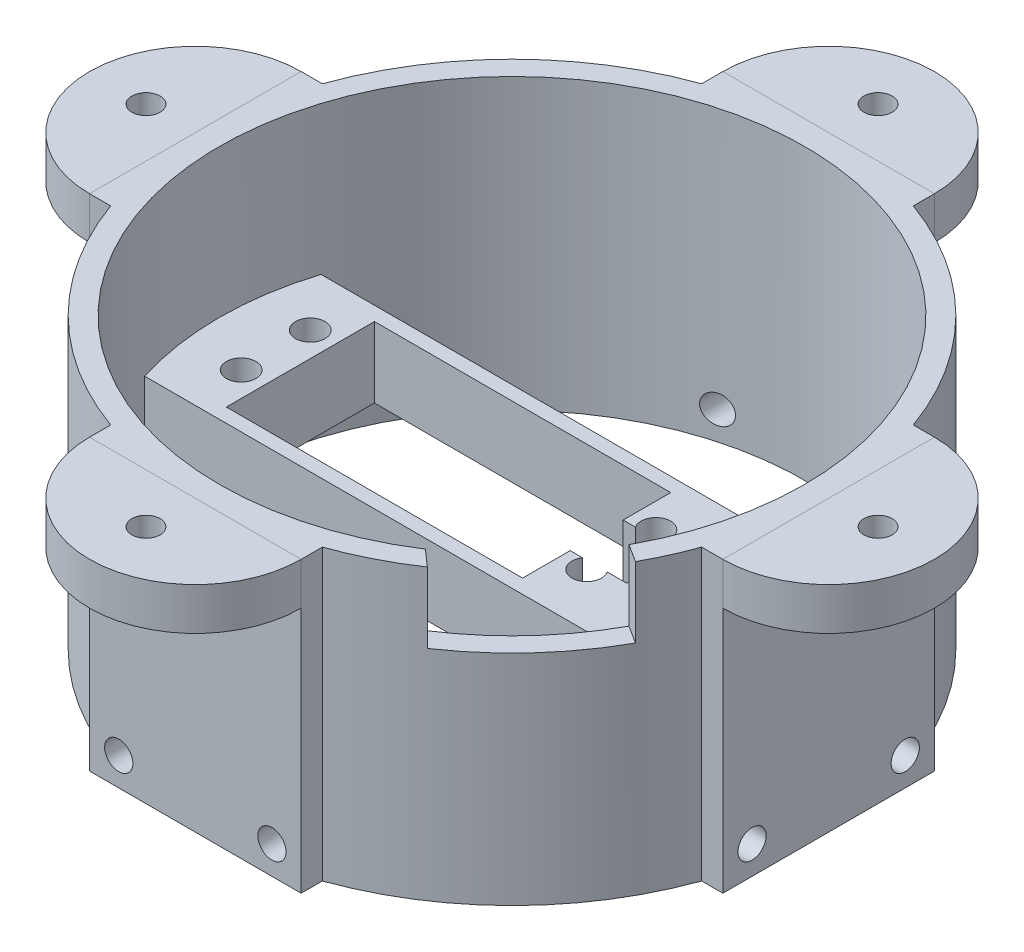
from build123d import *
from build123d.topology import SkipClean

# Parameters (mm, degrees)
SKETCH1_R             = 44.5
SKETCH1_R_2           = 41.5
BOSS_EXTRUDE1_DEPTH   = 41
SKETCH2_R             = 2.1
SKETCH2_W             = 42
SKETCH2_H             = 21
BOSS_EXTRUDE2_DEPTH   = 20
BOSS_EXTRUDE3_DEPTH   = 41
CIRPATTERN1_COUNT     = 4
SKETCH4_R             = 2
CUT_EXTRUDE1_DEPTH    = 7
CUT_EXTRUDE2_DEPTH    = 10
CIRPATTERN2_COUNT     = 4
SKETCH6_R             = 2
BOSS_EXTRUDE4_DEPTH   = 6
BOSS_EXTRUDE4_2_DEPTH = 6
BOSS_EXTRUDE4_3_DEPTH = 6
BOSS_EXTRUDE4_4_DEPTH = 6
SKETCH8_W             = 8
SKETCH8_H             = 7.5
CUT_EXTRUDE3_DEPTH    = 60
CUT_EXTRUDE4_START    = -10
CUT_EXTRUDE4_DEPTH    = 10


with BuildPart() as part:
    # Sketch1 → Boss-Extrude1 (new body)
    with BuildSketch(Plane(origin=(0, 0, 0), x_dir=(1, 0, 0), z_dir=(0, 1, 0))):
        with Locations(Location((0, 0, 0), (0, 0, 270))):
            Circle(SKETCH1_R)
        with Locations(Location((0, 0, 0), (0, 0, 270))):
            Circle(SKETCH1_R_2, mode=Mode.SUBTRACT)
    extrude(amount=BOSS_EXTRUDE1_DEPTH)

    # Sketch2 → Boss-Extrude2 (add)
    with BuildSketch(Plane(origin=(0, 0, 0), x_dir=(1, 0, 0), z_dir=(0, 1, 0))):
        with BuildLine():
            Line((-39.572717875, 12.5), (39.572717875, 12.5))
            ThreePointArc((39.572717875, 12.5), (41.658434963, 0), (39.572717875, -12.5))
            Line((39.572717875, -12.5), (-39.572717875, -12.5))
            ThreePointArc((-39.572717875, -12.5), (-41.658434963, 0), (-39.572717875, 12.5))
        make_face()
        with Locations(Location((15.5, 4.9, 0), (0, 0, 270))):
            Circle(SKETCH2_R, mode=Mode.SUBTRACT)
        with Locations(Location((15.5, -4.9, 0), (0, 0, 270))):
            Circle(SKETCH2_R, mode=Mode.SUBTRACT)
        with Locations(Location((-33.5, 4.9, 0), (0, 0, 90))):
            Circle(SKETCH2_R, mode=Mode.SUBTRACT)
        with Locations(Location((-33.5, -4.9, 0), (0, 0, 90))):
            Circle(SKETCH2_R, mode=Mode.SUBTRACT)
        with Locations((-9, 0)):
            Rectangle(SKETCH2_W, SKETCH2_H, mode=Mode.SUBTRACT)
    extrude(amount=BOSS_EXTRUDE2_DEPTH)

    # Sketch3 → Boss-Extrude3 (add)
    with BuildSketch(Plane(origin=(0, 0, 0), x_dir=(1, 0, 0), z_dir=(0, 1, 0))):
        with BuildLine():
            Line((0, 44.895703837), (-15, 44.895703837))
            Line((-15, 44.895703837), (-15, 41.895703837))
            ThreePointArc((-15, 41.895703837), (0, 44.5), (15, 41.895703837))
            Line((15, 41.895703837), (15, 44.895703837))
            Line((15, 44.895703837), (0, 44.895703837))
        make_face()
    boss_extrude3 = extrude(amount=BOSS_EXTRUDE3_DEPTH)

    # CirPattern1: Boss-Extrude3 ×4 about axis
    cirpattern1_axis = Axis((0, 0, 0), (0, 1, 0))
    for i in range(1, CIRPATTERN1_COUNT):
        add(boss_extrude3.rotate(cirpattern1_axis, i * 360 / CIRPATTERN1_COUNT))

    # Sketch4 → Cut-Extrude1 (cut)
    with BuildSketch(Plane.ZY.offset(44.895703837)):
        with Locations((10.859802344, 4)):
            Circle(SKETCH4_R)
        with Locations(Location((-10.859802344, 4, 0), (0, 0, 214.905312115))):
            Circle(SKETCH4_R)
    cut_extrude1 = extrude(amount=-CUT_EXTRUDE1_DEPTH, mode=Mode.SUBTRACT)

    # Sketch5 → Cut-Extrude2 (cut)
    with SkipClean():  # the faces are left unmerged after this step: merging them gives an invalid solid
        with BuildSketch(Plane(origin=(0, 0, 0), x_dir=(1, 0, 0), z_dir=(0, 1, 0))):
            with BuildLine():
                Line((-39.572717875, 12.5), (39.572717875, 12.5))
                ThreePointArc((39.572717875, 12.5), (41.5, 0), (39.572717875, -12.5))
                Line((39.572717875, -12.5), (-39.572717875, -12.5))
                ThreePointArc((-39.572717875, -12.5), (-41.5, 0), (-39.572717875, 12.5))
            make_face()
        extrude(amount=CUT_EXTRUDE2_DEPTH, mode=Mode.SUBTRACT)

    # CirPattern2: Cut-Extrude1 ×4 about axis
    with SkipClean():  # the faces are left unmerged after this step: merging them gives an invalid solid
        cirpattern2_axis = Axis((0, 41, 0), (0, -1, 0))
        for i in range(1, CIRPATTERN2_COUNT):
            add(cut_extrude1.rotate(cirpattern2_axis, i * 360 / CIRPATTERN2_COUNT), mode=Mode.SUBTRACT)

    # Sketch8 → Cut-Extrude3 (cut)
    with SkipClean():  # the faces are left unmerged after this step: merging them gives an invalid solid
        with BuildSketch(Plane(origin=(0, 0, 0), x_dir=(1, 0, 0), z_dir=(0, 1, 0))):
            with Locations((16, 0)):
                Rectangle(SKETCH8_W, SKETCH8_H)
        extrude(amount=CUT_EXTRUDE3_DEPTH, mode=Mode.SUBTRACT)

    # Sketch9 → Cut-Extrude4 (cut)
    with SkipClean():  # the faces are left unmerged after this step: merging them gives an invalid solid
        with BuildSketch(Plane(origin=(0, 41, 0), x_dir=(1, 0, 0), z_dir=(0, 1, 0)).offset(CUT_EXTRUDE4_START)):
            with BuildLine():
                Line((36.441495651, -19.856167674), (38.976205671, -21.473364699))
                ThreePointArc((38.976205671, -21.473364699), (32.849182071, -30.019680832), (24.887814069, -36.889655879))
                Line((24.887814069, -36.889655879), (22.556482536, -34.834682367))
                ThreePointArc((22.556482536, -34.834682367), (30.434837492, -28.212952112), (36.441495651, -19.856167674))
            make_face()
        extrude(amount=CUT_EXTRUDE4_DEPTH, mode=Mode.SUBTRACT)


with BuildPart() as body_2:
    # Sketch6 → Boss-Extrude4 (new body)
    with BuildSketch(Plane(origin=(0, 41, 0), x_dir=(1, 0, 0), z_dir=(0, 1, 0))):
        with BuildLine():
            Line((-44.895703837, 15), (-44.895703837, -15))
            ThreePointArc((-44.895703837, -15), (-59.895703837, 0), (-44.895703837, 15))
        make_face()
        with Locations(Location((-51.895703837, 0, 0), (0, 0, 270))):
            Circle(SKETCH6_R, mode=Mode.SUBTRACT)
    extrude(amount=-BOSS_EXTRUDE4_DEPTH)


with BuildPart() as body_3:
    # Sketch6 → Boss-Extrude4 2 (new body)
    with BuildSketch(Plane(origin=(0, 41, 0), x_dir=(1, 0, 0), z_dir=(0, 1, 0))):
        with BuildLine():
            Line((-15, 44.895703837), (15, 44.895703837))
            ThreePointArc((15, 44.895703837), (0, 59.895703837), (-15, 44.895703837))
        make_face()
        with Locations(Location((0, 51.895703837, 0), (0, 0, 270))):
            Circle(SKETCH6_R, mode=Mode.SUBTRACT)
    extrude(amount=-BOSS_EXTRUDE4_2_DEPTH)


with BuildPart() as body_4:
    # Sketch6 → Boss-Extrude4 3 (new body)
    with BuildSketch(Plane(origin=(0, 41, 0), x_dir=(1, 0, 0), z_dir=(0, 1, 0))):
        with BuildLine():
            Line((44.895703837, 15), (44.895703837, -15))
            ThreePointArc((44.895703837, -15), (59.895703837, 0), (44.895703837, 15))
        make_face()
        with Locations(Location((51.895703837, 0, 0), (0, 0, 270))):
            Circle(SKETCH6_R, mode=Mode.SUBTRACT)
    extrude(amount=-BOSS_EXTRUDE4_3_DEPTH)


with BuildPart() as body_5:
    # Sketch6 → Boss-Extrude4 4 (new body)
    with BuildSketch(Plane(origin=(0, 41, 0), x_dir=(1, 0, 0), z_dir=(0, 1, 0))):
        with BuildLine():
            Line((15, -44.895703837), (-15, -44.895703837))
            ThreePointArc((-15, -44.895703837), (0, -59.895703837), (15, -44.895703837))
        make_face()
        with Locations(Location((0, -51.895703837, 0), (0, 0, 270))):
            Circle(SKETCH6_R, mode=Mode.SUBTRACT)
    extrude(amount=-BOSS_EXTRUDE4_4_DEPTH)


solid = Compound([part.part, body_2.part, body_3.part, body_4.part, body_5.part])
